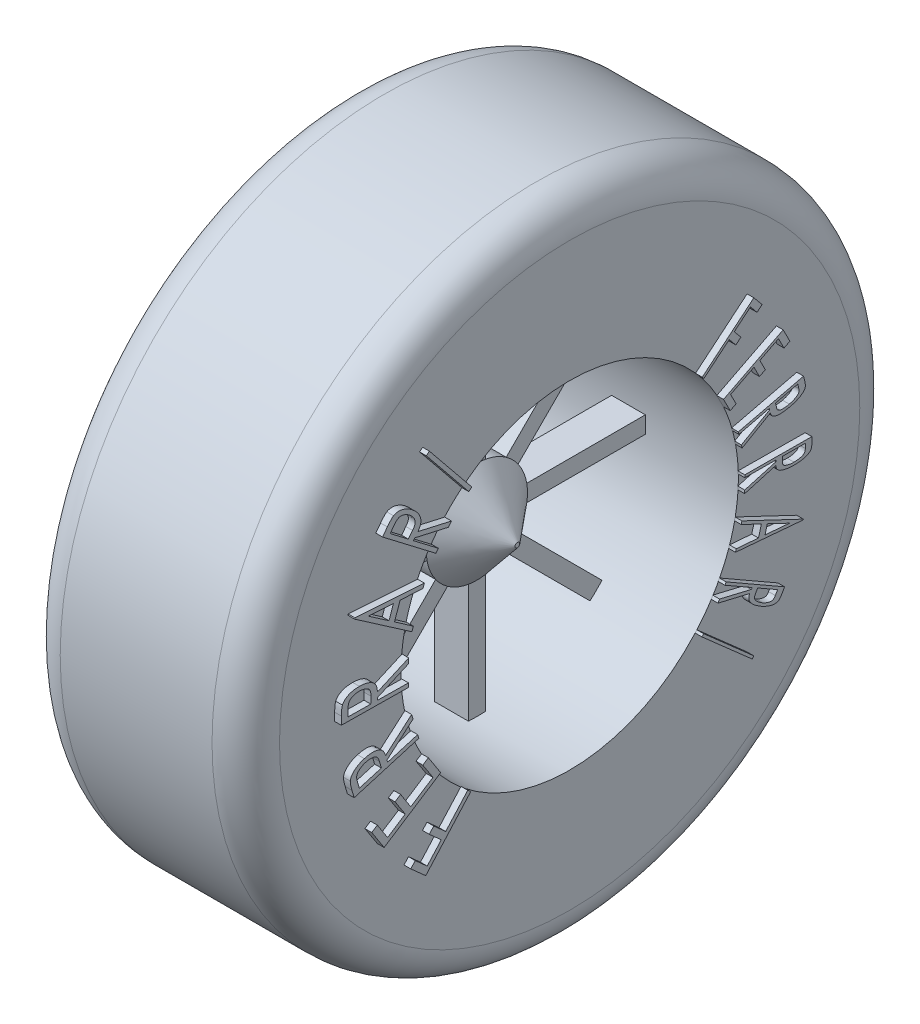
from build123d import *

# Parameters (mm, degrees)
CUT_EXTRUDE1_REACH  = 706.242
SKETCH3_R           = 75
BOSS_EXTRUDE1_DEPTH = 60
BOSS_EXTRUDE1_TAPER = 50
BOSS_EXTRUDE3_DEPTH = 10
BOSS_EXTRUDE4_DEPTH = 10


with BuildPart() as part:
    # Sketch1 → Revolve2 (revolve)
    with BuildSketch(Plane.XY, mode=Mode.PRIVATE) as revolve2_sk:
        with BuildLine():
            Line((-162.5, 250), (-25, 250))
            Line((-25, 250), (-25, 50))
            Line((-25, 50), (25, 50))
            Line((25, 50), (25, 250))
            Line((25, 250), (162.5, 250))
            Line((162.5, 250), (162.5, 430))
            ThreePointArc((162.5, 430), (147.855339059, 465.355339059), (112.5, 480))
            Line((112.5, 480), (-112.5, 480))
            ThreePointArc((-112.5, 480), (-147.855339059, 465.355339059), (-162.5, 430))
            Line((-162.5, 430), (-162.5, 250))
        make_face()
    revolve(revolve2_sk.sketch.rotate(Axis((-90.588285348, 0, 0), (1, 0, 0)), 90), axis=Axis((-90.588285348, 0, 0), (1, 0, 0)))

    # Sketch2 → Cut-Extrude1 (cut, up to next)
    with BuildSketch(Plane(origin=(25, 0, 0), x_dir=(0, 0, -1), z_dir=(1, 0, 0)), mode=Mode.PRIVATE) as cut_extrude1_sk1:
        with BuildLine():
            Line((-12.5, 249.687304443), (-12.5, 73.950997289))
            ThreePointArc((-12.5, 73.950997289), (-28.701257427, 69.290964938), (-43.452416894, 61.130086423))
            Line((-43.452416894, 61.130086423), (-167.716751383, 185.394420913))
            ThreePointArc((-167.716751383, 185.394420913), (-95.670858091, 230.969883128), (-12.5, 249.687304443))
        make_face()
    cut_extrude1_tool1 = extrude(cut_extrude1_sk1.sketch, amount=-CUT_EXTRUDE1_REACH, mode=Mode.PRIVATE) & part.part
    # Sketch2 → Cut-Extrude1 (cut, up to next)
    with BuildSketch(Plane(origin=(25, 0, 0), x_dir=(0, 0, -1), z_dir=(1, 0, 0)), mode=Mode.PRIVATE) as cut_extrude1_sk2:
        with BuildLine():
            Line((12.5, 249.687304443), (12.5, 73.950997289))
            ThreePointArc((12.5, 73.950997289), (28.701257427, 69.290964938), (43.452416894, 61.130086423))
            Line((43.452416894, 61.130086423), (167.716751383, 185.394420913))
            ThreePointArc((167.716751383, 185.394420913), (95.670858091, 230.969883128), (12.5, 249.687304443))
        make_face()
    cut_extrude1_tool2 = extrude(cut_extrude1_sk2.sketch, amount=-CUT_EXTRUDE1_REACH, mode=Mode.PRIVATE) & part.part
    # Sketch2 → Cut-Extrude1 (cut, up to next)
    with BuildSketch(Plane(origin=(25, 0, 0), x_dir=(0, 0, -1), z_dir=(1, 0, 0)), mode=Mode.PRIVATE) as cut_extrude1_sk3:
        with BuildLine():
            Line((185.394420913, 167.716751383), (61.130086423, 43.452416894))
            ThreePointArc((61.130086423, 43.452416894), (69.290964938, 28.701257427), (73.950997289, 12.5))
            Line((73.950997289, 12.5), (249.687304443, 12.5))
            ThreePointArc((249.687304443, 12.5), (230.969883128, 95.670858091), (185.394420913, 167.716751383))
        make_face()
    cut_extrude1_tool3 = extrude(cut_extrude1_sk3.sketch, amount=-CUT_EXTRUDE1_REACH, mode=Mode.PRIVATE) & part.part
    # Sketch2 → Cut-Extrude1 (cut, up to next)
    with BuildSketch(Plane(origin=(25, 0, 0), x_dir=(0, 0, -1), z_dir=(1, 0, 0)), mode=Mode.PRIVATE) as cut_extrude1_sk4:
        with BuildLine():
            Line((249.687304443, -12.5), (73.950997289, -12.5))
            ThreePointArc((73.950997289, -12.5), (69.290964938, -28.701257427), (61.130086423, -43.452416894))
            Line((61.130086423, -43.452416894), (185.394420913, -167.716751383))
            ThreePointArc((185.394420913, -167.716751383), (230.969883128, -95.670858091), (249.687304443, -12.5))
        make_face()
    cut_extrude1_tool4 = extrude(cut_extrude1_sk4.sketch, amount=-CUT_EXTRUDE1_REACH, mode=Mode.PRIVATE) & part.part
    # Sketch2 → Cut-Extrude1 (cut, up to next)
    with BuildSketch(Plane(origin=(25, 0, 0), x_dir=(0, 0, -1), z_dir=(1, 0, 0)), mode=Mode.PRIVATE) as cut_extrude1_sk5:
        with BuildLine():
            Line((167.716751383, -185.394420913), (43.452416894, -61.130086423))
            ThreePointArc((43.452416894, -61.130086423), (28.701257427, -69.290964938), (12.5, -73.950997289))
            Line((12.5, -73.950997289), (12.5, -249.687304443))
            ThreePointArc((12.5, -249.687304443), (95.670858091, -230.969883128), (167.716751383, -185.394420913))
        make_face()
    cut_extrude1_tool5 = extrude(cut_extrude1_sk5.sketch, amount=-CUT_EXTRUDE1_REACH, mode=Mode.PRIVATE) & part.part
    # Sketch2 → Cut-Extrude1 (cut, up to next)
    with BuildSketch(Plane(origin=(25, 0, 0), x_dir=(0, 0, -1), z_dir=(1, 0, 0)), mode=Mode.PRIVATE) as cut_extrude1_sk6:
        with BuildLine():
            Line((-12.5, -249.687304443), (-12.5, -73.950997289))
            ThreePointArc((-12.5, -73.950997289), (-28.701257427, -69.290964938), (-43.452416894, -61.130086423))
            Line((-43.452416894, -61.130086423), (-167.716751383, -185.394420913))
            ThreePointArc((-167.716751383, -185.394420913), (-95.670858091, -230.969883128), (-12.5, -249.687304443))
        make_face()
    cut_extrude1_tool6 = extrude(cut_extrude1_sk6.sketch, amount=-CUT_EXTRUDE1_REACH, mode=Mode.PRIVATE) & part.part
    # Sketch2 → Cut-Extrude1 (cut, up to next)
    with BuildSketch(Plane(origin=(25, 0, 0), x_dir=(0, 0, -1), z_dir=(1, 0, 0)), mode=Mode.PRIVATE) as cut_extrude1_sk7:
        with BuildLine():
            Line((-185.394420913, -167.716751383), (-61.130086423, -43.452416894))
            ThreePointArc((-61.130086423, -43.452416894), (-69.290964938, -28.701257427), (-73.950997289, -12.5))
            Line((-73.950997289, -12.5), (-249.687304443, -12.5))
            ThreePointArc((-249.687304443, -12.5), (-230.969883128, -95.670858091), (-185.394420913, -167.716751383))
        make_face()
    cut_extrude1_tool7 = extrude(cut_extrude1_sk7.sketch, amount=-CUT_EXTRUDE1_REACH, mode=Mode.PRIVATE) & part.part
    # Sketch2 → Cut-Extrude1 (cut, up to next)
    with BuildSketch(Plane(origin=(25, 0, 0), x_dir=(0, 0, -1), z_dir=(1, 0, 0)), mode=Mode.PRIVATE) as cut_extrude1_sk8:
        with BuildLine():
            Line((-249.687304443, 12.5), (-73.950997289, 12.5))
            ThreePointArc((-73.950997289, 12.5), (-69.290964938, 28.701257427), (-61.130086423, 43.452416894))
            Line((-61.130086423, 43.452416894), (-185.394420913, 167.716751383))
            ThreePointArc((-185.394420913, 167.716751383), (-230.969883128, 95.670858091), (-249.687304443, 12.5))
        make_face()
    cut_extrude1_tool8 = extrude(cut_extrude1_sk8.sketch, amount=-CUT_EXTRUDE1_REACH, mode=Mode.PRIVATE) & part.part
    add(cut_extrude1_tool1.solids().sort_by_distance((25, 165.253324, 68.450168))[0], mode=Mode.SUBTRACT)
    add(cut_extrude1_tool2.solids().sort_by_distance((25, 165.253324, -68.450168))[0], mode=Mode.SUBTRACT)
    add(cut_extrude1_tool3.solids().sort_by_distance((25, 68.450168, -165.253324))[0], mode=Mode.SUBTRACT)
    add(cut_extrude1_tool4.solids().sort_by_distance((25, -68.450168, -165.253324))[0], mode=Mode.SUBTRACT)
    add(cut_extrude1_tool5.solids().sort_by_distance((25, -165.253324, -68.450168))[0], mode=Mode.SUBTRACT)
    add(cut_extrude1_tool6.solids().sort_by_distance((25, -165.253324, 68.450168))[0], mode=Mode.SUBTRACT)
    add(cut_extrude1_tool7.solids().sort_by_distance((25, -68.450168, 165.253324))[0], mode=Mode.SUBTRACT)
    add(cut_extrude1_tool8.solids().sort_by_distance((25, 68.450168, 165.253324))[0], mode=Mode.SUBTRACT)

    # Sketch3 → Boss-Extrude1 (add)
    with BuildSketch(Plane(origin=(25, 0, 0), x_dir=(0, 0, -1), z_dir=(1, 0, 0))):
        Circle(SKETCH3_R)
    extrude(amount=BOSS_EXTRUDE1_DEPTH, taper=BOSS_EXTRUDE1_TAPER)

    # Sketch5 → Boss-Extrude3 (add)
    # profile 1 of 7: a face of its own
    with BuildSketch(Plane(origin=(162.5, 0, 0), x_dir=(0, 0, -1), z_dir=(1, 0, 0))):
        Polygon((262.984736171, 229.779491268), (275.284415659, 215.015869474), (267.752364376, 208.745837422), (257.896595146, 220.58477973), (233.998357966, 200.672920756), (243.854127197, 188.833978448), (236.322075915, 182.563946397), (226.466306684, 194.402888704), (189.006370787, 163.192952807), (186.56246053, 166.117632294), align=None)
    # profile 2 of 7: a face of its own
    with BuildSketch(Plane(origin=(162.5, 0, 0), x_dir=(0, 0, -1), z_dir=(1, 0, 0))):
        Polygon((306.453929785, 166.900004449), (316.409859272, 147.368754449), (307.695916964, 142.921639065), (299.482775939, 159.047440347), (271.83854517, 144.944876244), (279.991590041, 128.959299321), (271.337743888, 124.552248039), (263.184699016, 140.537824962), (228.509218246, 122.869555731), (236.662263118, 106.883978808), (227.948320811, 102.436863424), (218.052487477, 121.827889065), align=None)
    # profile 3 of 7: a face of its own
    with BuildSketch(Plane(origin=(162.5, 0, 0), x_dir=(0, 0, -1), z_dir=(1, 0, 0))):
        with BuildLine():
            Line((336.651086845, 92.408218001), (338.413907357, 85.076487232))
            add(Edge.make_bspline(
                [(338.413907357, 85.076487232), (338.620270096, 84.130356427), (338.996186841, 82.406855303), (339.337077434, 80.022143963), (339.422845334, 78.068835511), (339.180120266, 76.948196859), (339.07496505, 76.462705181)],
                knots=[0, 0, 0, 0, 1.332195302, 2.426768148, 3.318432423, 4, 4, 4, 4], degree=3))
            add(Edge.make_bspline(
                [(339.07496505, 76.462705181), (338.80946017, 75.825577371), (338.237249973, 74.452453721), (336.665050075, 72.584578261), (334.517528258, 70.779056074), (331.841561012, 68.971987283), (328.648065445, 67.266094836), (324.974300519, 65.744670985), (320.892084058, 64.329935851), (317.987539312, 63.587260378), (316.478811204, 63.201487232)],
                knots=[0, 0, 0, 0, 0.609354232, 1.313266652, 2.13621116, 3.095570898, 4.171429131, 5.341875722, 6.619271808, 8, 8, 8, 8], degree=3))
            add(Edge.make_bspline(
                [(316.478811204, 63.201487232), (315.199245364, 62.915735012), (312.717494545, 62.361511239), (309.061274878, 61.751097453), (305.595729332, 61.395249434), (302.349840803, 61.230056896), (299.369343959, 61.35656348), (296.683856584, 61.665426448), (294.330631845, 62.269922747), (292.269892048, 63.072894364), (290.528257073, 64.220607322), (289.125076501, 65.71768835), (288.022493888, 67.552521145), (287.608477007, 68.944784325), (287.392272742, 69.671839796)],
                knots=[0, 0, 0, 0, 1.429455452, 2.772465572, 4.038865345, 5.226750105, 6.312487256, 7.288728807, 8.168154931, 8.955067736, 9.690116764, 10.421478413, 11.175678298, 12, 12, 12, 12], degree=3))
            Line((287.392272742, 69.671839796), (245.605413768, 45.633378258))
            Line((245.605413768, 45.633378258), (244.523682998, 50.180653899))
            Line((244.523682998, 50.180653899), (286.290509921, 74.199083386))
            Line((286.290509921, 74.199083386), (285.789708639, 76.302448771))
            Line((285.789708639, 76.302448771), (240.837785562, 65.505173129))
            Line((240.837785562, 65.505173129), (239.956375306, 69.191070565))
            Line((239.956375306, 69.191070565), (336.651086845, 92.408218001))
        make_face()
        with BuildLine():
            Line((328.057336845, 86.458698771), (295.204772742, 78.566070565))
            Line((295.204772742, 78.566070565), (296.58698428, 72.195878258))
            add(Edge.make_bspline(
                [(296.58698428, 72.195878258), (296.739356346, 71.620594794), (297.024355635, 70.544574869), (297.749836179, 69.123191972), (298.618514276, 67.971789141), (299.727611581, 67.127837394), (301.036575333, 66.554800703), (302.559962448, 66.130047062), (304.333360205, 65.917919002), (306.321494403, 65.816399039), (308.484312187, 65.88361453), (310.765860035, 66.105424066), (313.138654743, 66.491881578), (314.737638733, 66.8460495), (315.557336845, 67.027609027)],
                knots=[0, 0, 0, 0, 0.962623695, 1.800507648, 2.571775339, 3.282254998, 4.03333821, 4.876802537, 5.838633974, 6.922954571, 8.103836411, 9.344153639, 10.638515295, 12, 12, 12, 12], degree=3))
            add(Edge.make_bspline(
                [(315.557336845, 67.027609027), (316.348053781, 67.231642643), (317.895483761, 67.630935638), (320.11298984, 68.377338773), (322.19576272, 69.200116491), (324.112668627, 70.104886012), (325.820407967, 71.066239245), (327.250490466, 72.058095663), (328.381033986, 73.064567973), (329.230425067, 74.113259591), (329.79669429, 75.309485888), (330.003282109, 76.701207491), (329.988925784, 78.294963503), (329.748769575, 79.396801913), (329.619836845, 79.988346206)],
                knots=[0, 0, 0, 0, 1.356368739, 2.654408367, 3.884286751, 5.075272854, 6.173349819, 7.136736633, 7.961353793, 8.680409551, 9.365365549, 10.131410669, 10.996809927, 12, 12, 12, 12], degree=3))
            Line((329.619836845, 79.988346206), (328.057336845, 86.458698771))
        make_face(mode=Mode.SUBTRACT)
    # profile 4 of 7: a face of its own
    with BuildSketch(Plane(origin=(162.5, 0, 0), x_dir=(0, 0, -1), z_dir=(1, 0, 0))):
        with BuildLine():
            Line((349.021434656, 8.6058912), (348.981370554, 1.093871969))
            add(Edge.make_bspline(
                [(348.981370554, 1.093871969), (348.966001173, 0.130812639), (348.937850814, -1.633114356), (348.651741379, -4.021399096), (348.278634104, -5.942640563), (347.777208728, -6.9719939), (347.559094913, -7.419749826)],
                knots=[0, 0, 0, 0, 1.325633025, 2.428012278, 3.316204851, 4, 4, 4, 4], degree=3))
            add(Edge.make_bspline(
                [(347.559094913, -7.419749826), (347.373684074, -7.699986771), (346.995015069, -8.272321411), (346.2433419, -9.039204843), (345.364837455, -9.777355379), (344.334956181, -10.47577097), (343.173363883, -11.140464169), (341.851245734, -11.734725729), (340.396098441, -12.315342578), (338.213378141, -13.047878112), (335.207923704, -13.811364737), (331.277232897, -14.411758245), (326.973070512, -14.773295861), (323.975456557, -14.798492674), (322.418870554, -14.811576749)],
                knots=[0, 0, 0, 0, 0.44602327, 0.910924032, 1.421512155, 1.970872692, 2.56354048, 3.199357152, 3.896991023, 4.646883995, 6.260308045, 8.013943493, 9.930140484, 12, 12, 12, 12], degree=3))
            add(Edge.make_bspline(
                [(322.418870554, -14.811576749), (321.109400452, -14.7862057), (318.567131319, -14.736949108), (314.877728159, -14.423364723), (311.421046992, -13.984753892), (308.236416319, -13.324834155), (305.363979747, -12.525154988), (302.844030641, -11.561097687), (300.686484544, -10.459500664), (298.896505007, -9.166668968), (297.467210312, -7.649719422), (296.488847392, -5.846918979), (295.85179537, -3.802522487), (295.789036145, -2.350102645), (295.756210297, -1.590422903)],
                knots=[0, 0, 0, 0, 1.428571194, 2.773497805, 4.037708425, 5.227877257, 6.318642191, 7.287329372, 8.167153036, 8.953990071, 9.6861452, 10.419929554, 11.173553352, 12, 12, 12, 12], degree=3))
            Line((295.756210297, -1.590422903), (249.402043631, -14.851640852))
            Line((249.402043631, -14.851640852), (249.442107733, -10.184172903))
            Line((249.442107733, -10.184172903), (295.776242348, 3.036980943))
            Line((295.776242348, 3.036980943), (295.7962744, 5.200442482))
            Line((295.7962744, 5.200442482), (249.54226799, 5.520955302))
            Line((249.54226799, 5.520955302), (249.562300041, 9.286980943))
            Line((249.562300041, 9.286980943), (349.021434656, 8.6058912))
        make_face()
        with BuildLine():
            Line((339.265825682, 4.899961713), (305.451723118, 5.140346328))
            Line((305.451723118, 5.140346328), (305.271434656, -1.350038287))
            add(Edge.make_bspline(
                [(305.271434656, -1.350038287), (305.28148054, -1.940435963), (305.300428072, -3.053984562), (305.681105734, -4.593153949), (306.222661209, -5.929080123), (307.091350765, -7.011532071), (308.228390179, -7.892227398), (309.628215529, -8.6327763), (311.284170433, -9.329216325), (313.215518947, -9.853842096), (315.332748227, -10.31997573), (317.604310061, -10.627502271), (319.99124138, -10.833862672), (321.623806186, -10.867888828), (322.458934656, -10.885294698)],
                knots=[0, 0, 0, 0, 0.954686834, 1.800634098, 2.557272333, 3.274510136, 4.022179913, 4.875376806, 5.836859522, 6.930386205, 8.115801502, 9.351940303, 10.645401374, 12, 12, 12, 12], degree=3))
            add(Edge.make_bspline(
                [(322.458934656, -10.885294698), (323.273924601, -10.882532047), (324.872706932, -10.877112498), (327.207048373, -10.690176634), (329.427354953, -10.389610011), (331.506131831, -9.984473747), (333.381688729, -9.454249803), (335.010104383, -8.845625379), (336.335334635, -8.126820398), (337.426686124, -7.330606514), (338.265850818, -6.310080116), (338.796505457, -5.014102272), (339.177213448, -3.474812772), (339.208757571, -2.35455796), (339.225761579, -1.750679313)],
                knots=[0, 0, 0, 0, 1.356342032, 2.660763718, 3.894847099, 5.085148676, 6.182997184, 7.136714019, 7.972417319, 8.686099796, 9.373590389, 10.139954128, 10.997333488, 12, 12, 12, 12], degree=3))
            Line((339.225761579, -1.750679313), (339.265825682, 4.899961713))
        make_face(mode=Mode.SUBTRACT)
    # profile 5 of 7: a face of its own
    with BuildSketch(Plane(origin=(162.5, 0, 0), x_dir=(0, 0, -1), z_dir=(1, 0, 0))):
        Polygon((336.138257186, -91.893650418), (235.717584109, -83.239804264), (236.799314878, -79.27345811), (269.872231545, -81.977785033), (274.139058468, -66.112400418), (244.191141801, -51.849579905), (245.312936673, -47.743009392), (336.378641801, -90.99220811), align=None)
        Polygon((315.945949494, -85.964163239), (282.953161032, -70.259035033), (279.567744365, -82.85919529), align=None, mode=Mode.SUBTRACT)
    # profile 6 of 7: a face of its own
    with BuildSketch(Plane(origin=(162.5, 0, 0), x_dir=(0, 0, -1), z_dir=(1, 0, 0))):
        with BuildLine():
            Line((308.565680812, -163.966310456), (304.77962312, -170.576887379))
            add(Edge.make_bspline(
                [(304.77962312, -170.576887379), (304.28683097, -171.421483076), (303.386385075, -172.96475589), (301.956064023, -174.936170989), (300.67499916, -176.442586655), (299.723956034, -177.101561109), (299.31087312, -177.387784815)],
                knots=[0, 0, 0, 0, 1.329976095, 2.430175713, 3.318151224, 4, 4, 4, 4], degree=3))
            add(Edge.make_bspline(
                [(299.31087312, -177.387784815), (298.67311233, -177.675661586), (297.312428324, -178.289856319), (294.873012766, -178.531143779), (292.067720508, -178.445379645), (288.867802165, -177.894964985), (285.378924195, -176.92820579), (281.643191345, -175.542089648), (277.705216056, -173.742535147), (275.075562515, -172.278636404), (273.709911581, -171.518393789)],
                knots=[0, 0, 0, 0, 0.615280768, 1.312722128, 2.139909061, 3.097275206, 4.174707771, 5.338802603, 6.617967481, 8, 8, 8, 8], degree=3))
            add(Edge.make_bspline(
                [(273.709911581, -171.518393789), (272.574025823, -170.849267515), (270.368818856, -169.550226737), (267.287536862, -167.466904103), (264.505463259, -165.353699449), (262.028308669, -163.241392535), (259.921222696, -161.104981796), (258.201384858, -159.003291378), (256.8790899, -156.951593634), (255.928471652, -154.942248988), (255.442112491, -152.902291647), (255.442516577, -150.830789313), (255.9475936, -148.736214879), (256.58915627, -147.42247311), (256.923052607, -146.738746353)],
                knots=[0, 0, 0, 0, 1.430181642, 2.776552568, 4.032910399, 5.219563351, 6.305723956, 7.284504422, 8.160821304, 8.94872438, 9.68510783, 10.416878894, 11.176076848, 12, 12, 12, 12], degree=3))
            Line((256.923052607, -146.738746353), (209.867764145, -135.60092584))
            Line((209.867764145, -135.60092584), (212.211514145, -131.494355327))
            Line((212.211514145, -131.494355327), (259.266802607, -142.652207892))
            Line((259.266802607, -142.652207892), (260.348533376, -140.769195071))
            Line((260.348533376, -140.769195071), (220.104142351, -117.712304045))
            Line((220.104142351, -117.712304045), (222.007187222, -114.386983533))
            Line((222.007187222, -114.386983533), (308.565680812, -163.966310456))
        make_face()
        with BuildLine():
            Line((298.189078248, -162.423842507), (268.761994915, -145.576887379))
            Line((268.761994915, -145.576887379), (265.376578248, -151.205893789))
            add(Edge.make_bspline(
                [(265.376578248, -151.205893789), (265.098506213, -151.732086067), (264.572343838, -152.72773663), (264.095422996, -154.26047603), (263.958064672, -155.71029564), (264.162237845, -157.087353933), (264.732656947, -158.41162427), (265.570189584, -159.761133386), (266.710588668, -161.156555162), (268.102730887, -162.604603384), (269.72989684, -164.043393876), (271.546706112, -165.449406872), (273.526413527, -166.818752794), (274.946072618, -167.648158389), (275.673052607, -168.072880968)],
                knots=[0, 0, 0, 0, 0.95889273, 1.814397755, 2.571348455, 3.29055331, 4.034822836, 4.881119446, 5.846947873, 6.936621923, 8.119466268, 9.347899893, 10.64191078, 12, 12, 12, 12], degree=3))
            add(Edge.make_bspline(
                [(275.673052607, -168.072880968), (276.390267537, -168.467634485), (277.793174129, -169.239791181), (279.91640701, -170.246258049), (282.007429051, -171.066301686), (284.030313224, -171.73290306), (285.939689755, -172.18914861), (287.670981115, -172.449759223), (289.185291021, -172.472690979), (290.539228357, -172.323016154), (291.761612518, -171.807078376), (292.88546416, -170.948825082), (293.927266664, -169.733993446), (294.523787667, -168.770128606), (294.843725684, -168.25316943)],
                knots=[0, 0, 0, 0, 1.35465795, 2.649775528, 3.885102551, 5.069768103, 6.171379836, 7.130923473, 7.959779158, 8.673965096, 9.367593977, 10.125656485, 10.994714779, 12, 12, 12, 12], degree=3))
            Line((294.843725684, -168.25316943), (298.189078248, -162.423842507))
        make_face(mode=Mode.SUBTRACT)
    # profile 7 of 7: a face of its own
    with BuildSketch(Plane(origin=(162.5, 0, 0), x_dir=(0, 0, -1), z_dir=(1, 0, 0))):
        Polygon((263.086819791, -229.863006628), (260.582813381, -232.70755791), (186.003486458, -166.962365602), (188.507492868, -164.11781432), align=None)
    extrude(amount=BOSS_EXTRUDE3_DEPTH)

    # Sketch6 → Boss-Extrude4 (add)
    # profile 1 of 7: a face of its own
    with BuildSketch(Plane(origin=(162.5, 0, 0), x_dir=(0, 0, -1), z_dir=(1, 0, 0))):
        Polygon((-223.301144167, -268.811119121), (-245.436560834, -249.019452454), (-238.866048014, -241.667689634), (-221.117650578, -257.5531063), (-200.284317244, -234.235798608), (-218.03271468, -218.350381941), (-211.46220186, -210.998619121), (-193.713804424, -226.884035787), (-161.021496732, -190.325542198), (-156.634477501, -194.231792198), align=None)
    # profile 2 of 7: a face of its own
    with BuildSketch(Plane(origin=(162.5, 0, 0), x_dir=(0, 0, -1), z_dir=(1, 0, 0))):
        Polygon((-284.91995882, -201.805683954), (-303.349446, -173.320107031), (-295.096240872, -167.99158139), (-279.871881897, -191.509209595), (-253.66995882, -174.562094211), (-268.754093436, -151.244786518), (-260.54095241, -145.916260877), (-245.456817795, -169.23356857), (-212.584221641, -147.979562159), (-227.668356256, -124.662254467), (-219.415151128, -119.313696775), (-201.125888308, -147.598953185), align=None)
    # profile 3 of 7: a face of its own
    with BuildSketch(Plane(origin=(162.5, 0, 0), x_dir=(0, 0, -1), z_dir=(1, 0, 0))):
        with BuildLine():
            Line((-329.340064188, -115.753490375), (-332.645352649, -104.555573708))
            add(Edge.make_bspline(
                [(-332.645352649, -104.555573708), (-332.860358997, -103.808124277), (-333.274168083, -102.369555749), (-333.846745541, -100.298652091), (-334.277105394, -98.389111588), (-334.647054364, -96.66928769), (-334.914636783, -95.125766357), (-335.067885566, -93.754704695), (-335.177250658, -92.557123242), (-335.130676935, -91.81524174), (-335.109294957, -91.474644221)],
                knots=[0, 0, 0, 0, 1.396467576, 2.687692599, 3.856762187, 4.910133748, 5.846329464, 6.667185017, 7.388105143, 8, 8, 8, 8], degree=3))
            add(Edge.make_bspline(
                [(-335.109294957, -91.474644221), (-335.053505796, -91.011891882), (-334.94065654, -90.075845225), (-334.567383263, -88.702435374), (-334.066197585, -87.333681626), (-333.379694657, -86.004806228), (-332.54680569, -84.685687014), (-331.562192622, -83.391663758), (-330.436370655, -82.094193797), (-328.666790773, -80.403575591), (-326.145688991, -78.364730996), (-322.613266681, -76.311321187), (-318.648816029, -74.451871216), (-315.77105853, -73.539301414), (-314.275961623, -73.065189093)],
                knots=[0, 0, 0, 0, 0.570493171, 1.153982769, 1.739133837, 2.35391367, 2.982745275, 3.648805279, 4.344657228, 5.085345759, 6.645658019, 8.304352041, 10.079980041, 12, 12, 12, 12], degree=3))
            add(Edge.make_bspline(
                [(-314.275961623, -73.065189093), (-313.005597308, -72.716205462), (-310.538367506, -72.03842917), (-306.849735715, -71.408291694), (-303.32597536, -71.059572987), (-299.976950811, -71.109547015), (-296.845168208, -71.438583486), (-293.982012848, -72.16325642), (-291.397507702, -73.207212084), (-289.075917546, -74.601715049), (-287.043998855, -76.455522513), (-285.315589296, -78.798114886), (-283.814802741, -81.608288801), (-283.114013283, -83.715798544), (-282.745512905, -84.824003195)],
                knots=[0, 0, 0, 0, 1.239795745, 2.407861253, 3.519019059, 4.569101647, 5.556454487, 6.477520384, 7.340370967, 8.172837536, 9.014067028, 9.911921097, 10.902012785, 12, 12, 12, 12], degree=3))
            Line((-282.745512905, -84.824003195), (-244.203846239, -51.45060576))
            Line((-244.203846239, -51.45060576), (-242.140544957, -58.401727554))
            Line((-242.140544957, -58.401727554), (-280.702243675, -91.735060888))
            Line((-280.702243675, -91.735060888), (-279.760737264, -94.940189093))
            Line((-279.760737264, -94.940189093), (-235.229487264, -81.759099349))
            Line((-235.229487264, -81.759099349), (-233.566827008, -87.38810576))
            Line((-233.566827008, -87.38810576), (-329.340064188, -115.753490375))
        make_face()
        with BuildLine():
            Line((-321.627724444, -107.340028836), (-289.075641111, -97.70461217))
            Line((-289.075641111, -97.70461217), (-291.800000085, -88.009099349))
            add(Edge.make_bspline(
                [(-291.800000085, -88.009099349), (-292.072907243, -87.139745215), (-292.584960349, -85.508584321), (-293.611757393, -83.340882111), (-294.714683099, -81.562710409), (-296.027701794, -80.226560497), (-297.510808014, -79.239195268), (-299.179963908, -78.48598658), (-301.091049533, -77.999645497), (-303.196173548, -77.732329815), (-305.437630382, -77.677110759), (-307.76557974, -77.838784633), (-310.152580698, -78.241494373), (-311.741806942, -78.673798187), (-312.553205213, -78.894516016)],
                knots=[0, 0, 0, 0, 1.255348978, 2.355399347, 3.300617618, 4.127757323, 4.917112721, 5.74568701, 6.641557444, 7.626334204, 8.667471789, 9.729223168, 10.840628008, 12, 12, 12, 12], degree=3))
            add(Edge.make_bspline(
                [(-312.553205213, -78.894516016), (-313.333320626, -79.147019428), (-314.864836, -79.642731795), (-317.02749375, -80.621928274), (-319.052761328, -81.707893459), (-320.846813581, -82.989981194), (-322.432542633, -84.323192137), (-323.705747998, -85.737471993), (-324.70059305, -87.171194973), (-325.38884253, -88.713685293), (-325.680329099, -90.48155247), (-325.633453972, -92.52334861), (-325.250298156, -94.900156123), (-324.79664402, -96.566886652), (-324.552403931, -97.464227554)],
                knots=[0, 0, 0, 0, 1.154909967, 2.267308583, 3.341501272, 4.388632284, 5.3697208, 6.25612265, 7.062780244, 7.821619876, 8.615491459, 9.566175024, 10.689667789, 12, 12, 12, 12], degree=3))
            Line((-324.552403931, -97.464227554), (-321.627724444, -107.340028836))
        make_face(mode=Mode.SUBTRACT)
    # profile 4 of 7: a face of its own
    with BuildSketch(Plane(origin=(162.5, 0, 0), x_dir=(0, 0, -1), z_dir=(1, 0, 0))):
        with BuildLine():
            Line((-348.397693241, -13.208521063), (-348.257468882, -1.469739012))
            add(Edge.make_bspline(
                [(-348.257468882, -1.469739012), (-348.238103092, -0.681839942), (-348.201170207, 0.82077808), (-348.137675441, 2.979651455), (-347.981663604, 4.934628872), (-347.843809142, 6.702083826), (-347.609577126, 8.262303125), (-347.385076798, 9.638039802), (-347.091232513, 10.809316035), (-346.846234626, 11.51241482), (-346.735032984, 11.831543039)],
                knots=[0, 0, 0, 0, 1.407265291, 2.68382369, 3.855168644, 4.90864201, 5.847769494, 6.671000618, 7.396782905, 8, 8, 8, 8], degree=3))
            add(Edge.make_bspline(
                [(-346.735032984, 11.831543039), (-346.541641955, 12.255594674), (-346.151942704, 13.110094519), (-345.435034165, 14.339957094), (-344.53889267, 15.490468343), (-343.492078985, 16.563645927), (-342.32329386, 17.592341718), (-341.017834219, 18.564049259), (-339.539442134, 19.431062186), (-337.381637461, 20.579242256), (-334.365334097, 21.753399516), (-330.413038602, 22.720870268), (-326.08540652, 23.290005646), (-323.078973079, 23.316273115), (-321.51468042, 23.329940475)],
                knots=[0, 0, 0, 0, 0.572144863, 1.152920201, 1.743339434, 2.358026781, 2.991300317, 3.653836269, 4.352718381, 5.093580883, 6.654262407, 8.310820446, 10.080464242, 12, 12, 12, 12], degree=3))
            add(Edge.make_bspline(
                [(-321.51468042, 23.329940475), (-320.204130664, 23.293976566), (-317.654153216, 23.224000468), (-313.965191754, 22.722262015), (-310.509617467, 22.00439815), (-307.33567136, 20.954242208), (-304.446815473, 19.705026815), (-301.928026843, 18.16421036), (-299.773515507, 16.402740045), (-298.002725881, 14.3485624), (-296.604193074, 11.977238736), (-295.65528254, 9.20631118), (-295.071904536, 6.060193806), (-295.019661458, 3.828202593), (-294.992244523, 2.656863552)],
                knots=[0, 0, 0, 0, 1.233786346, 2.400616492, 3.500782395, 4.552718041, 5.543623831, 6.45816284, 7.324475419, 8.153850945, 8.999374535, 9.900344708, 10.898110261, 12, 12, 12, 12], degree=3))
            Line((-294.992244523, 2.656863552), (-248.477821446, 23.289876373))
            Line((-248.477821446, 23.289876373), (-248.577981702, 15.998209706))
            Line((-248.577981702, 15.998209706), (-295.092404779, -4.594739012))
            Line((-295.092404779, -4.594739012), (-295.132468882, -7.960123627))
            Line((-295.132468882, -7.960123627), (-248.878462472, -8.521021063))
            Line((-248.878462472, -8.521021063), (-248.938558625, -14.41044414))
            Line((-248.938558625, -14.41044414), (-348.397693241, -13.208521063))
        make_face()
        with BuildLine():
            Line((-338.602020164, -7.439290294), (-304.7879176, -7.83993132))
            Line((-304.7879176, -7.83993132), (-304.527500933, 2.296286629))
            add(Edge.make_bspline(
                [(-304.527500933, 2.296286629), (-304.534455325, 3.218619391), (-304.547408123, 4.936496332), (-304.85444674, 7.337424497), (-305.420261575, 9.354453301), (-306.237068524, 11.051323787), (-307.381503578, 12.419685721), (-308.740574421, 13.654518198), (-310.424133992, 14.676846159), (-312.351463044, 15.54971978), (-314.466899126, 16.259194382), (-316.735491957, 16.774470039), (-319.119705128, 17.132669643), (-320.758782979, 17.177345487), (-321.594808625, 17.200132783)],
                knots=[0, 0, 0, 0, 1.270995657, 2.367273745, 3.325829304, 4.14926106, 4.94147987, 5.769479297, 6.671174668, 7.643382239, 8.682710025, 9.741228265, 10.8478942, 12, 12, 12, 12], degree=3))
            add(Edge.make_bspline(
                [(-321.594808625, 17.200132783), (-322.409996196, 17.18583009), (-324.011350557, 17.157733882), (-326.361726511, 16.904680004), (-328.594971529, 16.419853432), (-330.681650614, 15.746948713), (-332.570896962, 14.919268018), (-334.221086935, 13.96280397), (-335.577540056, 12.857809299), (-336.6926438, 11.58651277), (-337.500816033, 9.987475317), (-338.028399117, 8.006520464), (-338.385483887, 5.614044503), (-338.435100214, 3.873692203), (-338.461795805, 2.93731227)],
                knots=[0, 0, 0, 0, 1.149208592, 2.257505212, 3.326683375, 4.365759106, 5.343663341, 6.230094676, 7.04619082, 7.80083512, 8.596696143, 9.547206257, 10.680297752, 12, 12, 12, 12], degree=3))
            Line((-338.461795805, 2.93731227), (-338.602020164, -7.439290294))
        make_face(mode=Mode.SUBTRACT)
    # profile 5 of 7: a face of its own
    with BuildSketch(Plane(origin=(162.5, 0, 0), x_dir=(0, 0, -1), z_dir=(1, 0, 0))):
        Polygon((-328.162738214, 114.509270134), (-225.318186932, 107.738436801), (-227.381488214, 101.808949621), (-261.295751034, 103.832186801), (-269.528924111, 80.034109878), (-241.624276675, 60.663116288), (-243.747674111, 54.513276544), (-328.643507445, 113.147090647), align=None)
        Polygon((-308.471231804, 106.937154749), (-277.742065137, 85.623052185), (-271.191584368, 104.533308596), align=None, mode=Mode.SUBTRACT)
    # profile 6 of 7: a face of its own
    with BuildSketch(Plane(origin=(162.5, 0, 0), x_dir=(0, 0, -1), z_dir=(1, 0, 0))):
        with BuildLine():
            Line((-287.318421225, 197.900422045), (-280.166978918, 207.255389994))
            add(Edge.make_bspline(
                [(-280.166978918, 207.255389994), (-279.688477205, 207.878109451), (-278.770285349, 209.073039205), (-277.418147241, 210.758646679), (-276.120775003, 212.236013077), (-274.95729098, 213.568606193), (-273.841872699, 214.692892616), (-272.835672601, 215.651922665), (-271.912435873, 216.432840096), (-271.296364087, 216.842268773), (-271.012331482, 217.031031019)],
                knots=[0, 0, 0, 0, 1.401657557, 2.689625802, 3.855589635, 4.910604692, 5.84603048, 6.680678256, 7.391742324, 8, 8, 8, 8], degree=3))
            add(Edge.make_bspline(
                [(-271.012331482, 217.031031019), (-270.602511042, 217.25949639), (-269.776604188, 217.719920267), (-268.450530081, 218.266781487), (-267.032914938, 218.635979556), (-265.553182826, 218.901339095), (-263.989690383, 219.020475617), (-262.355955831, 218.988905948), (-260.639296242, 218.858336728), (-258.228268004, 218.434590378), (-255.10666581, 217.586466704), (-251.337404417, 216.022773833), (-247.528293227, 213.875920812), (-245.093388885, 212.102622467), (-243.828837892, 211.181672045)],
                knots=[0, 0, 0, 0, 0.574236166, 1.157252152, 1.750271871, 2.364552693, 2.996004496, 3.666477241, 4.363780399, 5.101696841, 6.660613978, 8.314044762, 10.085724242, 12, 12, 12, 12], degree=3))
            add(Edge.make_bspline(
                [(-243.828837892, 211.181672045), (-242.800108847, 210.363156489), (-240.799075781, 208.771020349), (-238.107068731, 206.180030981), (-235.785246722, 203.505596829), (-233.840581116, 200.770854754), (-232.288634463, 198.025501873), (-231.172990417, 195.280658621), (-230.527860017, 192.565187648), (-230.297881104, 189.857140086), (-230.617380828, 187.116200505), (-231.489099627, 184.321400805), (-232.921315331, 181.443264175), (-234.21320386, 179.614242671), (-234.89454302, 178.649620763)],
                knots=[0, 0, 0, 0, 1.233762293, 2.399853638, 3.502131163, 4.554501101, 5.545216036, 6.45675684, 7.326552903, 8.156460946, 8.995553053, 9.899886348, 10.892404692, 12, 12, 12, 12], degree=3))
            Line((-234.89454302, 178.649620763), (-185.154959687, 167.391607943))
            Line((-185.154959687, 167.391607943), (-189.602075072, 161.582313071))
            Line((-189.602075072, 161.582313071), (-239.321626354, 172.860357943))
            Line((-239.321626354, 172.860357943), (-241.364895584, 170.176063071))
            Line((-241.364895584, 170.176063071), (-204.545985328, 142.031031019))
            Line((-204.545985328, 142.031031019), (-208.131722508, 137.343531019))
            Line((-208.131722508, 137.343531019), (-287.318421225, 197.900422045))
        make_face()
        with BuildLine():
            Line((-275.9802802, 196.658434866), (-249.077235328, 176.085518199))
            Line((-249.077235328, 176.085518199), (-242.767139174, 184.078306661))
            add(Edge.make_bspline(
                [(-242.767139174, 184.078306661), (-242.220188065, 184.820370516), (-241.199289393, 186.205452275), (-240.051706329, 188.332296194), (-239.255662781, 190.280720204), (-238.948764705, 192.145961843), (-238.981977851, 193.942074697), (-239.397938289, 195.734214335), (-240.077392863, 197.577433737), (-241.124003043, 199.41754302), (-242.382322077, 201.267317529), (-243.912711012, 203.033301034), (-245.623916586, 204.748872898), (-246.916115313, 205.772197611), (-247.574831482, 206.293851532)],
                knots=[0, 0, 0, 0, 1.266034318, 2.363086449, 3.316373095, 4.145128975, 4.944205547, 5.770873171, 6.662886609, 7.636823196, 8.673454547, 9.735159593, 10.845466286, 12, 12, 12, 12], degree=3))
            add(Edge.make_bspline(
                [(-247.574831482, 206.293851532), (-248.23512617, 206.772178011), (-249.528152369, 207.708863825), (-251.564995307, 208.907298039), (-253.652900525, 209.843066422), (-255.738408623, 210.562303588), (-257.749440493, 211.045931172), (-259.650044082, 211.275166293), (-261.394669935, 211.169206113), (-263.050621047, 210.818914979), (-264.652459121, 210.010580303), (-266.265955592, 208.74523635), (-268.00492371, 207.048270327), (-269.085977058, 205.674217507), (-269.670184046, 204.931672045)],
                knots=[0, 0, 0, 0, 1.146894186, 2.245912703, 3.31821956, 4.361144842, 5.345680357, 6.224519567, 7.043296339, 7.795423839, 8.589626492, 9.542354685, 10.671875382, 12, 12, 12, 12], degree=3))
            Line((-269.670184046, 204.931672045), (-275.9802802, 196.658434866))
        make_face(mode=Mode.SUBTRACT)
    # profile 7 of 7: a face of its own
    with BuildSketch(Plane(origin=(162.5, 0, 0), x_dir=(0, 0, -1), z_dir=(1, 0, 0))):
        Polygon((-222.36740427, 269.654035387), (-217.860192731, 273.319900771), (-155.019647859, 195.976150771), (-159.526859398, 192.310285387), align=None)
    extrude(amount=BOSS_EXTRUDE4_DEPTH)


solid = part.part
